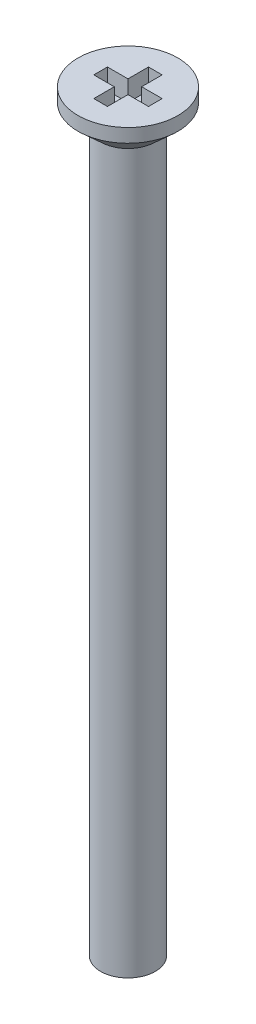
from build123d import *

# Parameters (mm, degrees)
SKETCH3_W          = 1.5
SKETCH3_H          = 1
SKETCH3_W_2        = 1
SKETCH3_H_2        = 1.5
CUT_EXTRUDE1_DEPTH = 1.5


with BuildPart() as part:
    # Sketch2 → Revolve1 (revolve)
    with BuildSketch(Plane.XY, mode=Mode.PRIVATE) as revolve1_sk:
        Polygon((0, 2.5), (3.65, 2.5), (3.65, 1.5), (2, 0), (2, -52.5), (0, -52.5), align=None)
    revolve(revolve1_sk.sketch.rotate(Axis((0, 27.929971315, 0), (0, -1, 0)), 180), axis=Axis((0, 27.929971315, 0), (0, -1, 0)))

    # Sketch3 → Cut-Extrude1 (cut)
    with BuildSketch(Plane(origin=(0, 2.5, 0), x_dir=(1, 0, 0), z_dir=(0, 1, 0))):
        with Locations((1.25, 0)):
            Rectangle(SKETCH3_W, SKETCH3_H)
        with Locations((0, 1.25)):
            Rectangle(SKETCH3_W_2, SKETCH3_H_2)
        with Locations((-1.25, 0)):
            Rectangle(SKETCH3_W, SKETCH3_H)
        Rectangle(SKETCH3_W_2, SKETCH3_H)
        with Locations((0, -1.25)):
            Rectangle(SKETCH3_W_2, SKETCH3_H_2)
    extrude(amount=-CUT_EXTRUDE1_DEPTH, mode=Mode.SUBTRACT)


solid = part.part
